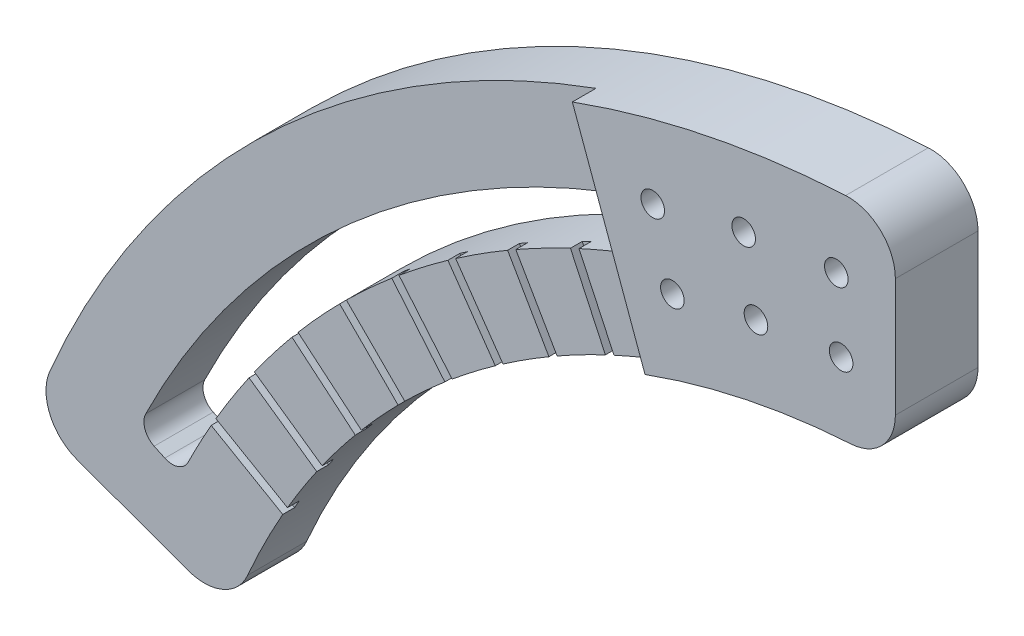
from build123d import *

# Parameters (mm, degrees)
BOSS_EXTRUDE2_DEPTH = 5
SKETCH1_5_R         = 1
BOSS_EXTRUDE3_DEPTH = 7
FILLET1_R           = 1.5
CUT_EXTRUDE1_DEPTH  = 1


with BuildPart() as part:
    # Sketch1 → Boss-Extrude2 (new body)
    with BuildSketch(Plane.XY):
        with BuildLine():
            ThreePointArc((-56.868678478, 24.697234828), (-42.491353844, 45.149583038), (-21.205248886, 58.260942489))
            Line((-21.205248886, 58.260942489), (-23.257369746, 63.899098213))
            Line((-23.257369746, 63.899098213), (-23.599389889, 64.838790834))
            ThreePointArc((-23.599389889, 64.838790834), (-46.615724325, 50.87213624), (-62.535237306, 29.16066006))
            Line((-62.535237306, 29.16066006), (-66.160468454, 30.851133107))
            ThreePointArc((-66.160468454, 30.851133107), (-49.318085156, 53.821245587), (-24.967470463, 68.597561317))
            Line((-24.967470463, 68.597561317), (-25.309490606, 69.537253938))
            Line((-25.309490606, 69.537253938), (-27.361611466, 75.175409663))
            ThreePointArc((-27.361611466, 75.175409663), (-55.059776129, 58.038100009), (-73.631131577, 31.280288725))
            ThreePointArc((-73.631131577, 31.280288725), (-73.618051339, 28.121820986), (-71.317655571, 25.957503806))
            Line((-71.317655571, 25.957503806), (-61.90570605, 22.531834333))
            ThreePointArc((-61.90570605, 22.531834333), (-58.95783549, 22.615790046), (-56.868678478, 24.697234828))
        make_face()
    extrude(amount=BOSS_EXTRUDE2_DEPTH)

    # Sketch1<5> → Boss-Extrude3 (add)
    with BuildSketch(Plane.XY):
        with BuildLine():
            ThreePointArc((-21.205248886, 58.260942489), (-12.61233393, 60.703616308), (-3.757575758, 61.886029315))
            ThreePointArc((-3.757575758, 61.886029315), (-1.087123675, 63.137298701), (0, 65.878676368))
            Line((0, 65.878676368), (0, 75.894663844))
            ThreePointArc((0, 75.894663844), (-1.247011194, 78.796568844), (-4.210526316, 79.889119836))
            ThreePointArc((-4.210526316, 79.889119836), (-15.961038091, 78.39161475), (-27.361611466, 75.175409663))
            Line((-27.361611466, 75.175409663), (-21.205248886, 58.260942489))
        make_face()
        with Locations((-4.594594595, 67.844599641)):
            Circle(SKETCH1_5_R, mode=Mode.SUBTRACT)
        with Locations((-11.808076081, 66.966927205)):
            Circle(SKETCH1_5_R, mode=Mode.SUBTRACT)
        with Locations((-18.886713057, 65.324513545)):
            Circle(SKETCH1_5_R, mode=Mode.SUBTRACT)
        with Locations((-20.553187739, 71.088441211)):
            Circle(SKETCH1_5_R, mode=Mode.SUBTRACT)
        with Locations((-12.849965147, 72.875773723)):
            Circle(SKETCH1_5_R, mode=Mode.SUBTRACT)
        with Locations((-5, 73.830887845)):
            Circle(SKETCH1_5_R, mode=Mode.SUBTRACT)
    extrude(amount=BOSS_EXTRUDE3_DEPTH)

    # Fillet1
    fillet1_edges = [part.edges().sort_by_distance(p)[0] for p in [
        (-24.967470463, 68.597561317, 2.5),
        (-23.599389889, 64.838790834, 2.5),
        (-62.535237306, 29.16066006, 2.5),
        (-66.160468454, 30.851133107, 2.5),
    ]]
    fillet(fillet1_edges, radius=FILLET1_R)

    # Sketch2 → Cut-Extrude1 (cut)
    with BuildSketch(Plane.XY.offset(5)):
        Polygon((-26.182734595, 55.202574904), (-25.457688366, 55.540669514), (-29.670325491, 64.574698983), (-30.395371721, 64.236604373), align=None)
        Polygon((-30.894322803, 52.71053676), (-35.87829712, 61.343033502), (-35.185476797, 61.743033502), (-30.20150248, 53.11053676), align=None)
        Polygon((-35.370786559, 49.817339603), (-41.088167015, 57.982605105), (-40.43284538, 58.441466254), (-34.715464924, 50.276200752), align=None)
        Polygon((-39.578057272, 46.545002412), (-45.985331149, 54.180894073), (-45.372495595, 54.695124161), (-38.965221718, 47.059232499), align=None)
        Polygon((-43.484115072, 42.918429647), (-50.532519147, 49.966833722), (-49.966833722, 50.532519147), (-42.918429647, 43.484115072), align=None)
        Polygon((-47.059232499, 38.965221718), (-54.695124161, 45.372495595), (-54.180894073, 45.985331149), (-46.545002412, 39.578057272), align=None)
        Polygon((-50.276200752, 34.715464924), (-58.441466254, 40.43284538), (-57.982605105, 41.088167015), (-49.817339603, 35.370786559), align=None)
        Polygon((-53.11053676, 30.20150248), (-61.743033502, 35.185476797), (-61.343033502, 35.878297121), (-52.71053676, 30.894322803), align=None)
    extrude(amount=-CUT_EXTRUDE1_DEPTH, mode=Mode.SUBTRACT)


solid = part.part
